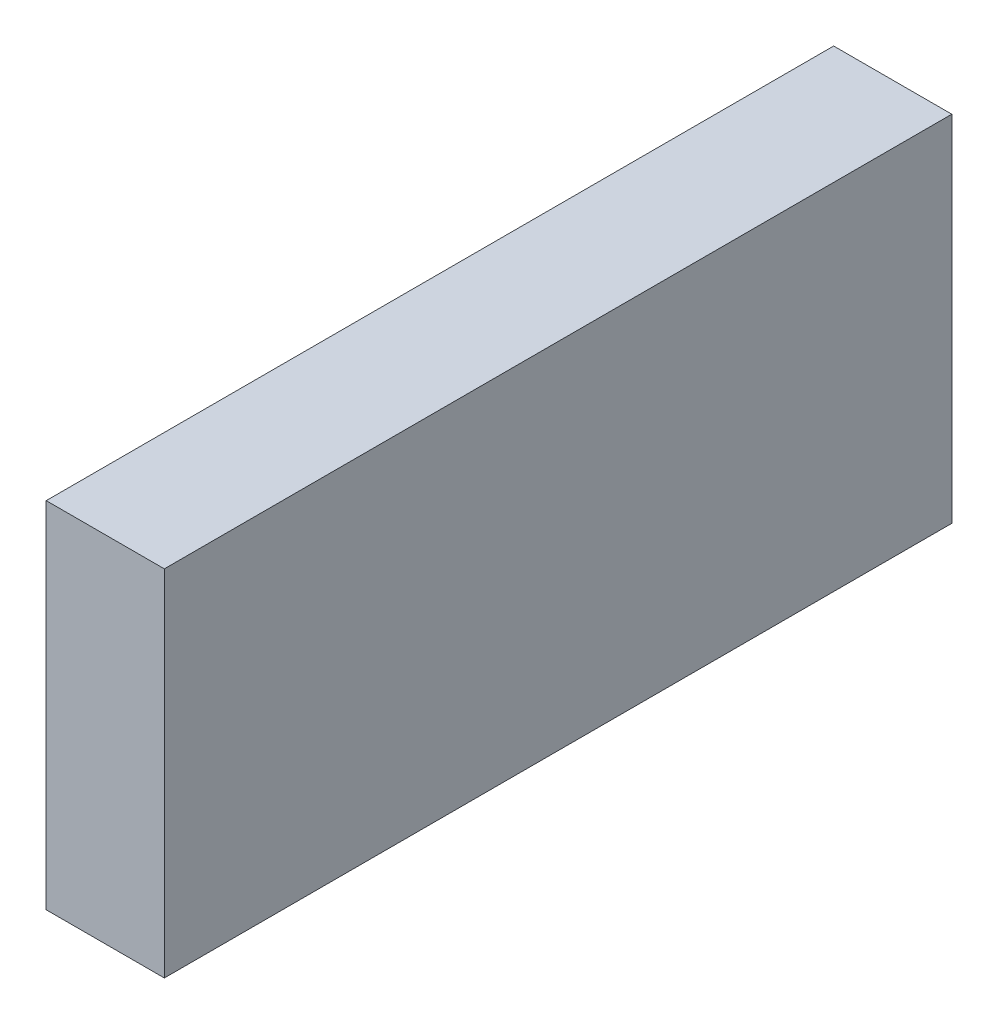
from build123d import *

# Parameters (mm, degrees)
SKETCH1_W           = 30
SKETCH1_H           = 90
BOSS_EXTRUDE1_DEPTH = 100


with BuildPart() as part:
    # Sketch1 → Boss-Extrude1 (new, symmetric)
    with BuildSketch(Plane.XY):
        Rectangle(SKETCH1_W, SKETCH1_H)
    extrude(amount=BOSS_EXTRUDE1_DEPTH, both=True)


solid = part.part
